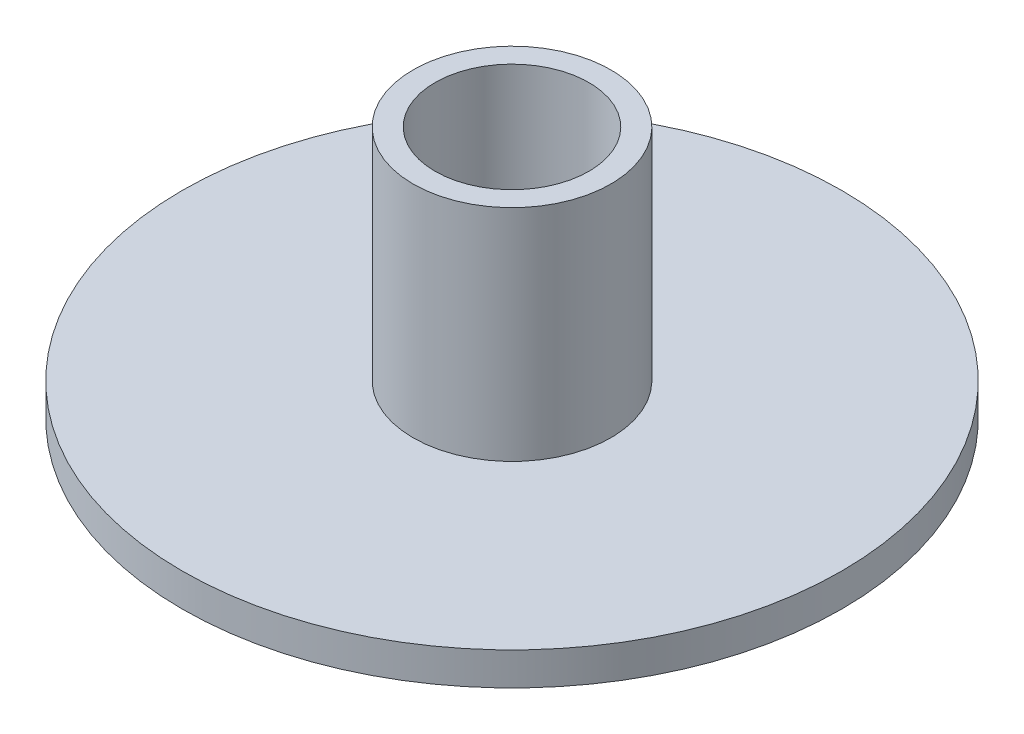
from build123d import *


with BuildPart() as part:
    # Sketch1 → Revolve1 (revolve)
    with BuildSketch(Plane(origin=(0, 0, 0), x_dir=(0, 0, -1), z_dir=(1, 0, 0))):
        Polygon((-9, 3.37389395), (-30, 3.37389395), (-30, 0.37389395), (-5, 0.37389395), (-5, 13.37389395), (-7, 13.37389395), (-7, 23.37389395), (-9, 23.37389395), align=None)
    revolve(axis=Axis((0, 28.058626224, 0), (0, -1, 0)))


solid = part.part
